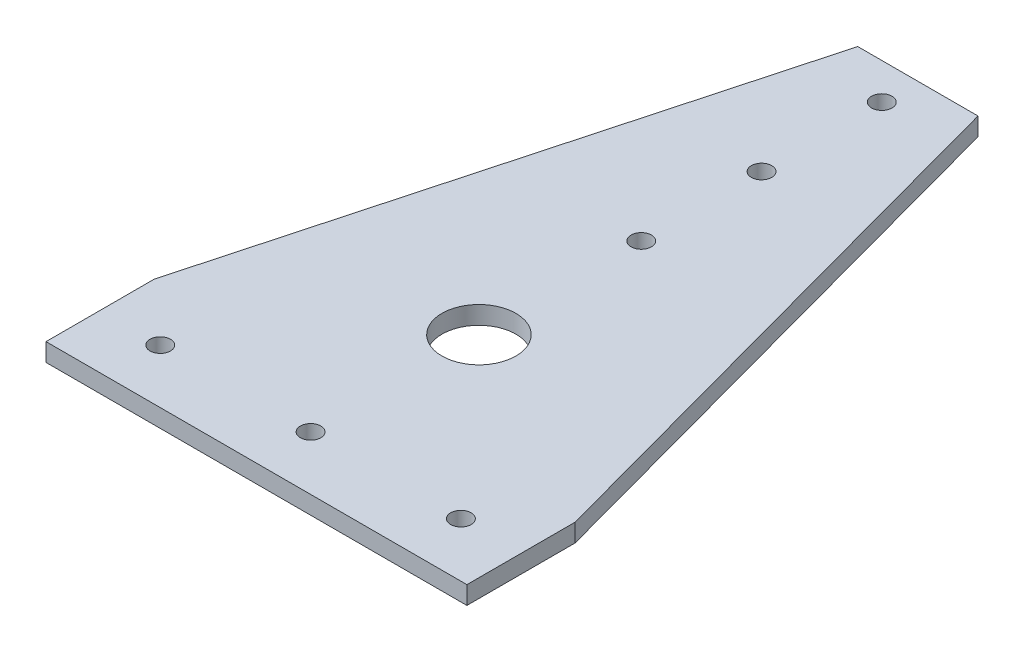
from build123d import *

# Parameters (mm, degrees)
SKETCH_1_R      = 1.7
SKETCH_1_R_2    = 6.15
EXTRUDE_1_DEPTH = 3


with BuildPart() as part:
    # 草图1 → 凸台-拉伸1 (new body)
    with BuildSketch(Plane(origin=(0, 0, 0), x_dir=(1, 0, 0), z_dir=(0, 1, 0))):
        Polygon((35, -9), (-35, -9), (-35, 9), (-10, 101), (10, 101), (35, 9), align=None)
        Circle(SKETCH_1_R, mode=Mode.SUBTRACT)
        with Locations((-25, 0)):
            Circle(SKETCH_1_R, mode=Mode.SUBTRACT)
        with Locations((25, 0)):
            Circle(SKETCH_1_R, mode=Mode.SUBTRACT)
        with Locations((0, 28)):
            Circle(SKETCH_1_R_2, mode=Mode.SUBTRACT)
        with Locations((0, 55)):
            Circle(SKETCH_1_R, mode=Mode.SUBTRACT)
        with Locations((0, 75)):
            Circle(SKETCH_1_R, mode=Mode.SUBTRACT)
        with Locations((0, 95)):
            Circle(SKETCH_1_R, mode=Mode.SUBTRACT)
    extrude(amount=EXTRUDE_1_DEPTH)


solid = part.part
